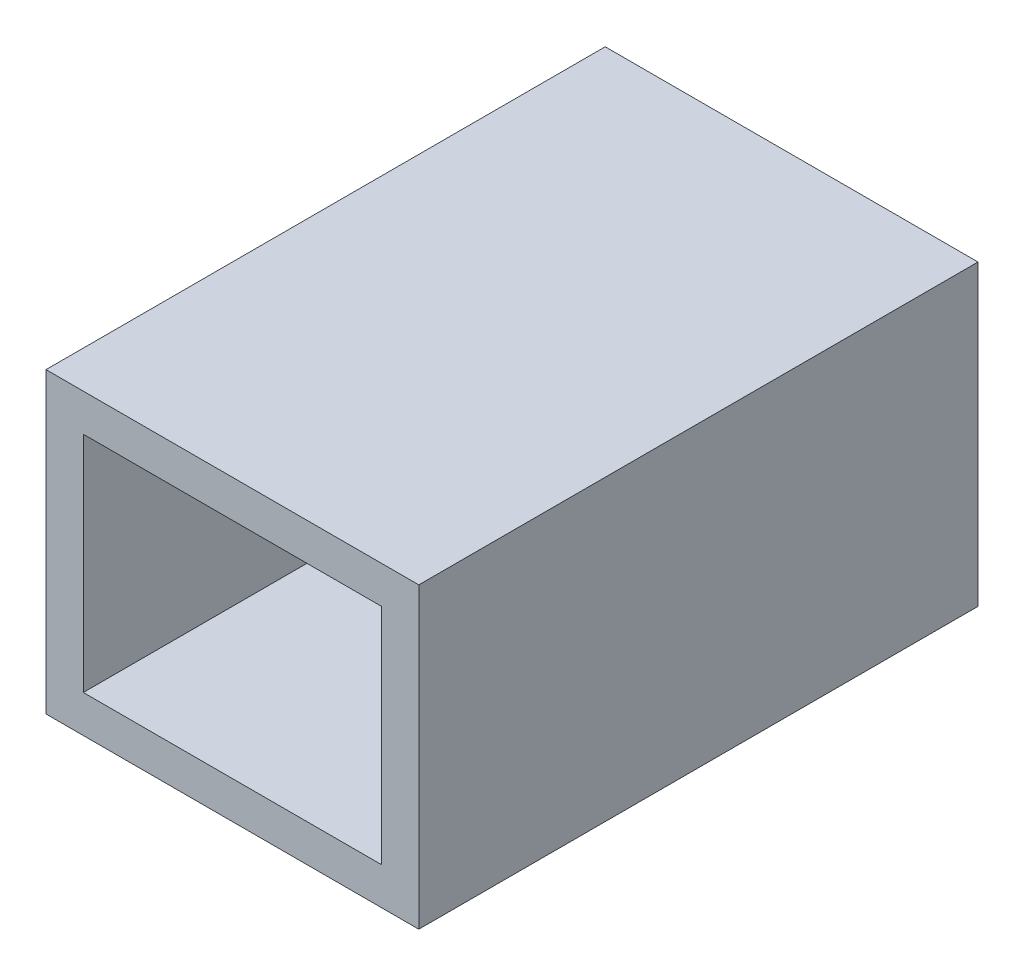
from build123d import *

# Parameters (mm, degrees)
SKETCH1_W           = 100
SKETCH1_H           = 80
SKETCH1_W_2         = 80
SKETCH1_H_2         = 60
BOSS_EXTRUDE1_DEPTH = 150


with BuildPart() as part:
    # Sketch1 → Boss-Extrude1 (new body)
    with BuildSketch(Plane.XY):
        Rectangle(SKETCH1_W, SKETCH1_H)
        Rectangle(SKETCH1_W_2, SKETCH1_H_2, mode=Mode.SUBTRACT)
    extrude(amount=BOSS_EXTRUDE1_DEPTH)


solid = part.part
